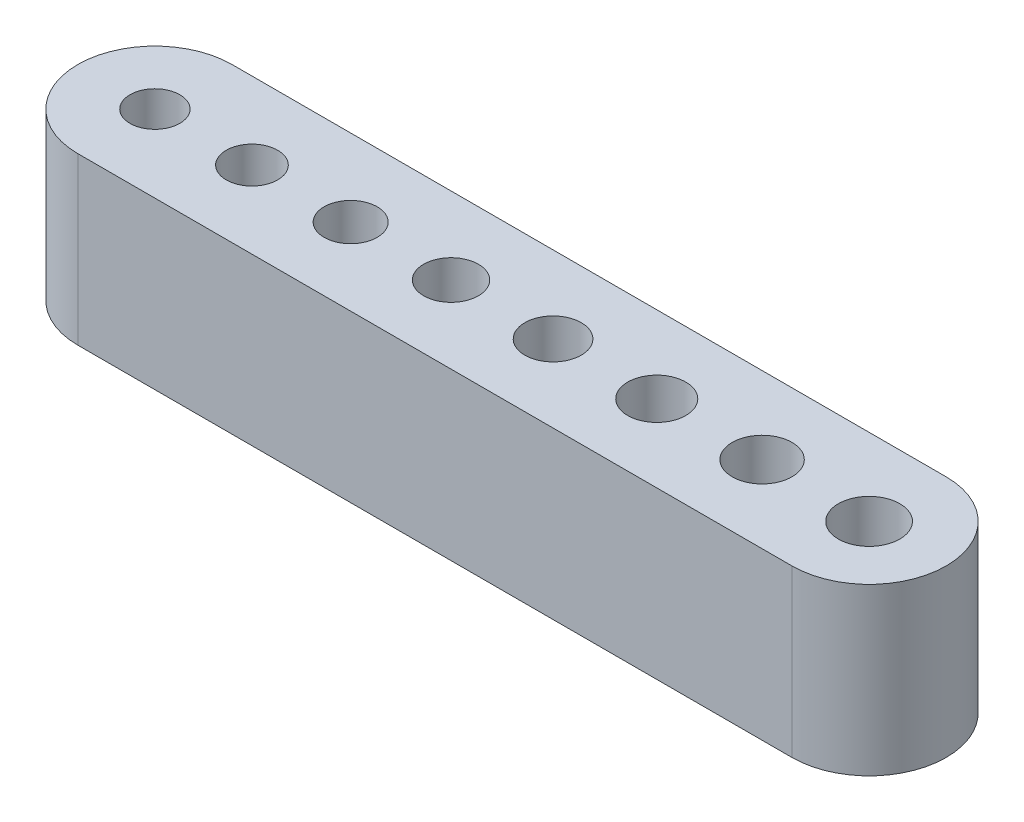
from build123d import *

# Parameters (mm, degrees)
SKETCH1_R           = 1.5
SKETCH1_R_2         = 1.55
SKETCH1_R_3         = 1.6
SKETCH1_R_4         = 1.65
SKETCH1_R_5         = 1.7
SKETCH1_R_6         = 1.85
SKETCH1_R_7         = 1.75
SKETCH1_R_8         = 1.8
BOSS_EXTRUDE1_DEPTH = 10


with BuildPart() as part:
    # Sketch1 → Boss-Extrude1 (new body)
    with BuildSketch(Plane(origin=(0, 0, 0), x_dir=(1, 0, 0), z_dir=(0, 1, 0))):
        with BuildLine():
            Line((-21.525, 4.65), (21.525, 4.65))
            ThreePointArc((21.525, 4.65), (26.175, 0), (21.525, -4.65))
            Line((21.525, -4.65), (-21.525, -4.65))
            ThreePointArc((-21.525, -4.65), (-26.175, 0), (-21.525, 4.65))
        make_face()
        with Locations(Location((-21.525, 0, 0), (0, 0, 270))):
            Circle(SKETCH1_R, mode=Mode.SUBTRACT)
        with Locations(Location((-15.675, 0, 0), (0, 0, 270))):
            Circle(SKETCH1_R_2, mode=Mode.SUBTRACT)
        with Locations(Location((-9.725, 0, 0), (0, 0, 270))):
            Circle(SKETCH1_R_3, mode=Mode.SUBTRACT)
        with Locations(Location((-3.675, 0, 0), (0, 0, 270))):
            Circle(SKETCH1_R_4, mode=Mode.SUBTRACT)
        with Locations(Location((2.475, 0, 0), (0, 0, 270))):
            Circle(SKETCH1_R_5, mode=Mode.SUBTRACT)
        with Locations(Location((21.525, 0, 0), (0, 0, 270))):
            Circle(SKETCH1_R_6, mode=Mode.SUBTRACT)
        with Locations(Location((8.725, 0, 0), (0, 0, 270))):
            Circle(SKETCH1_R_7, mode=Mode.SUBTRACT)
        with Locations(Location((15.075, 0, 0), (0, 0, 270))):
            Circle(SKETCH1_R_8, mode=Mode.SUBTRACT)
    extrude(amount=BOSS_EXTRUDE1_DEPTH)


solid = part.part
